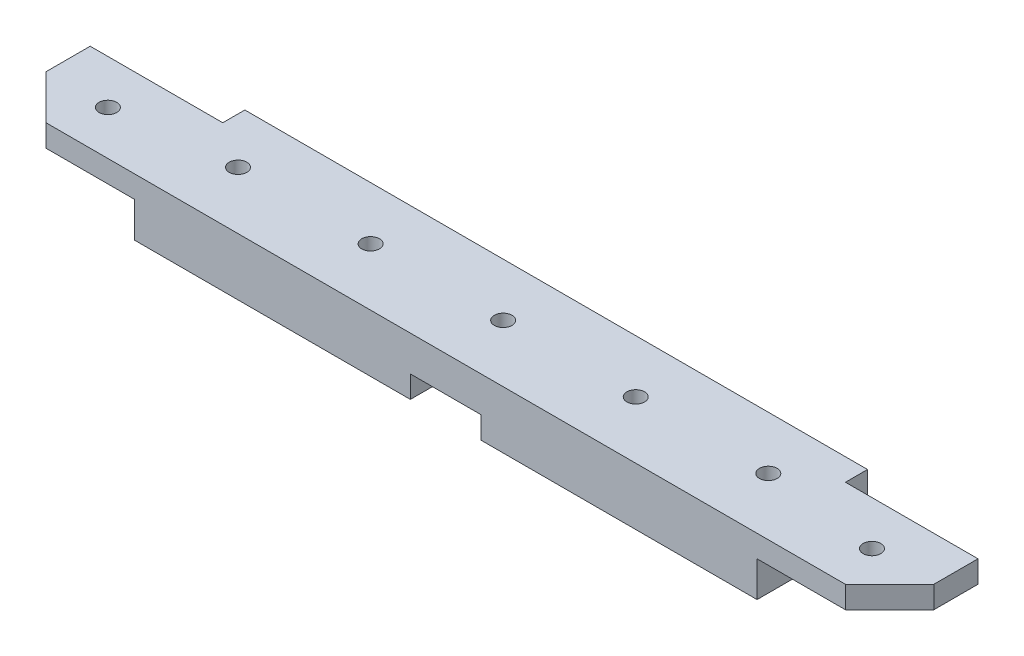
from build123d import *

# Parameters (mm, degrees)
BOSS_EXTRUDE1_DEPTH = 5
SKETCH2_R           = 2
CUT_EXTRUDE1_DEPTH  = 203.531099834
SKETCH3_W           = 140.92
SKETCH3_H           = 25
BOSS_EXTRUDE2_DEPTH = 8
SKETCH4_R           = 2
CUT_EXTRUDE2_DEPTH  = 203.886289335
SKETCH5_R           = 4
CUT_EXTRUDE3_DEPTH  = 5
CHAMFER1_SIZE       = 10
CUT_EXTRUDE4_DEPTH  = 5
SKETCH8_R           = 2
CUT_EXTRUDE5_DEPTH  = 203.627358469


with BuildPart() as part:
    # Sketch1 → Boss-Extrude1 (new body)
    with BuildSketch(Plane(origin=(0, 0, 0), x_dir=(1, 0, 0), z_dir=(0, 1, 0))):
        Polygon((170.92, 20), (200.92, 20), (200.92, 0), (0, 0), (0, 20), (30, 20), (30, 25), (170.92, 25), align=None)
    extrude(amount=BOSS_EXTRUDE1_DEPTH)

    # Sketch2 → Cut-Extrude1 (cut, through all)
    with BuildSketch(Plane(origin=(0, 5, 0), x_dir=(1, 0, 0), z_dir=(0, 1, 0))):
        with Locations(Location((14, 10, 0), (0, 0, 270))):
            Circle(SKETCH2_R)
        with Locations(Location((186.92, 10, 0), (0, 0, 270))):
            Circle(SKETCH2_R)
    extrude(amount=-CUT_EXTRUDE1_DEPTH, mode=Mode.SUBTRACT)

    # Sketch3 → Boss-Extrude2 (add)
    with BuildSketch(Plane(origin=(0, 0, 0), x_dir=(1, 0, 0), z_dir=(0, 1, 0))):
        with Locations((100.46, 12.5)):
            Rectangle(SKETCH3_W, SKETCH3_H)
    extrude(amount=-BOSS_EXTRUDE2_DEPTH)

    # Sketch4 → Cut-Extrude2 (cut, through all)
    with BuildSketch(Plane(origin=(0, 5, 0), x_dir=(1, 0, 0), z_dir=(0, 1, 0))):
        with Locations(Location((70.46, 13, 0), (0, 0, 270))):
            Circle(SKETCH4_R)
        with Locations(Location((40.46, 13, 0), (0, 0, 270))):
            Circle(SKETCH4_R)
        with Locations(Location((160.46, 13, 0), (0, 0, 90))):
            Circle(SKETCH4_R)
        with Locations(Location((130.46, 13, 0), (0, 0, 90))):
            Circle(SKETCH4_R)
    extrude(amount=-CUT_EXTRUDE2_DEPTH, mode=Mode.SUBTRACT)

    # Sketch5 → Cut-Extrude3 (cut)
    with BuildSketch(Plane.XZ.offset(8)):
        with Locations(Location((40.46, -13, 0), (0, 0, 270))):
            Circle(SKETCH5_R)
        with Locations(Location((130.46, -13, 0), (0, 0, 270))):
            Circle(SKETCH5_R)
        with Locations(Location((160.46, -13, 0), (0, 0, 270))):
            Circle(SKETCH5_R)
        with Locations(Location((70.46, -13, 0), (0, 0, 270))):
            Circle(SKETCH5_R)
    extrude(amount=-CUT_EXTRUDE3_DEPTH, mode=Mode.SUBTRACT)

    # Chamfer1
    chamfer1_edges = [part.edges().sort_by_distance(p)[0] for p in [
        (200.92, 2.5, 0),
        (0, 2.5, 0),
    ]]
    chamfer(chamfer1_edges, length=CHAMFER1_SIZE)

    # Sketch6 → Cut-Extrude4 (cut)
    with BuildSketch(Plane.XZ.offset(8)):
        Polygon((92.46, 0), (108.46, 0), (108.46, -10.07179677), (104.46, -17), (96.46, -17), (92.46, -10.07179677), align=None)
    extrude(amount=-CUT_EXTRUDE4_DEPTH, mode=Mode.SUBTRACT)

    # Sketch8 → Cut-Extrude5 (cut, through all)
    with BuildSketch(Plane.XZ.offset(3)):
        with Locations(Location((100.46, -13, 0), (0, 0, 270))):
            Circle(SKETCH8_R)
    extrude(amount=-CUT_EXTRUDE5_DEPTH, mode=Mode.SUBTRACT)


solid = part.part
